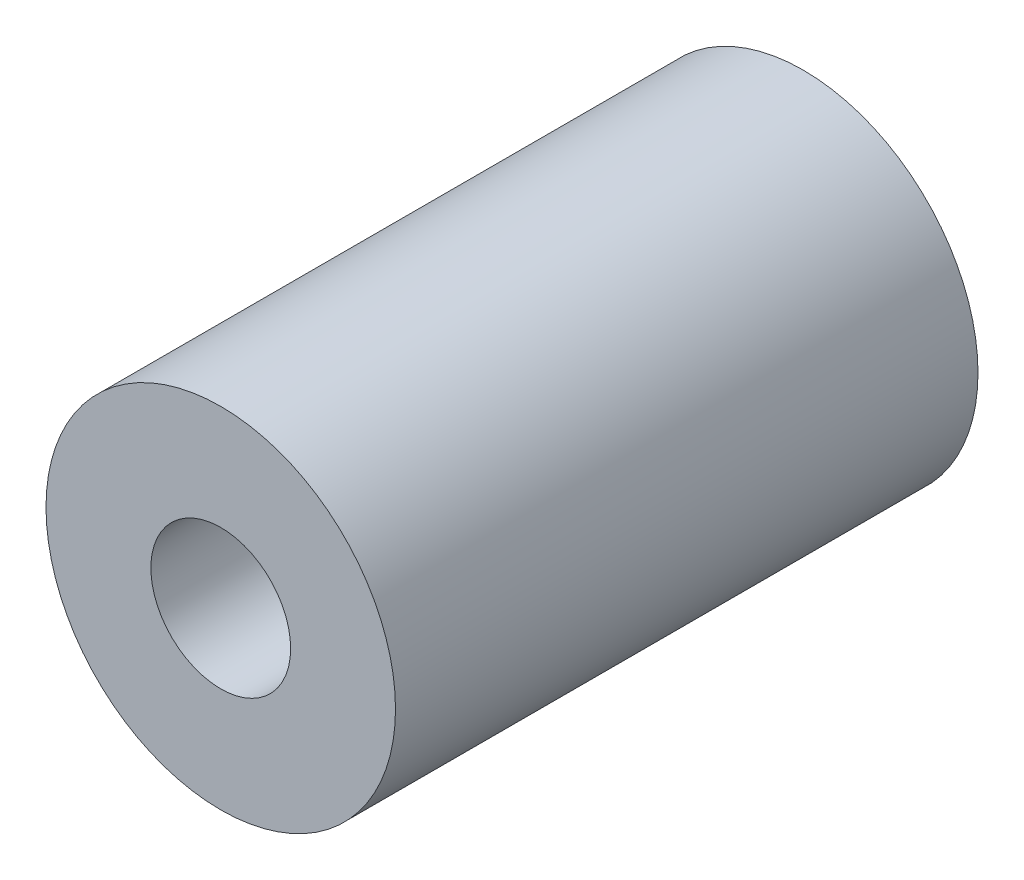
from build123d import *

# Parameters (mm, degrees)
SKETCH_1_R      = 15
SKETCH_1_R_2    = 6
EXTRUDE_1_DEPTH = 50


with BuildPart() as part:
    # 草图1 → 凸台-拉伸1 (new body)
    with BuildSketch(Plane.XY):
        Circle(SKETCH_1_R)
        Circle(SKETCH_1_R_2, mode=Mode.SUBTRACT)
    extrude(amount=EXTRUDE_1_DEPTH)


solid = part.part
